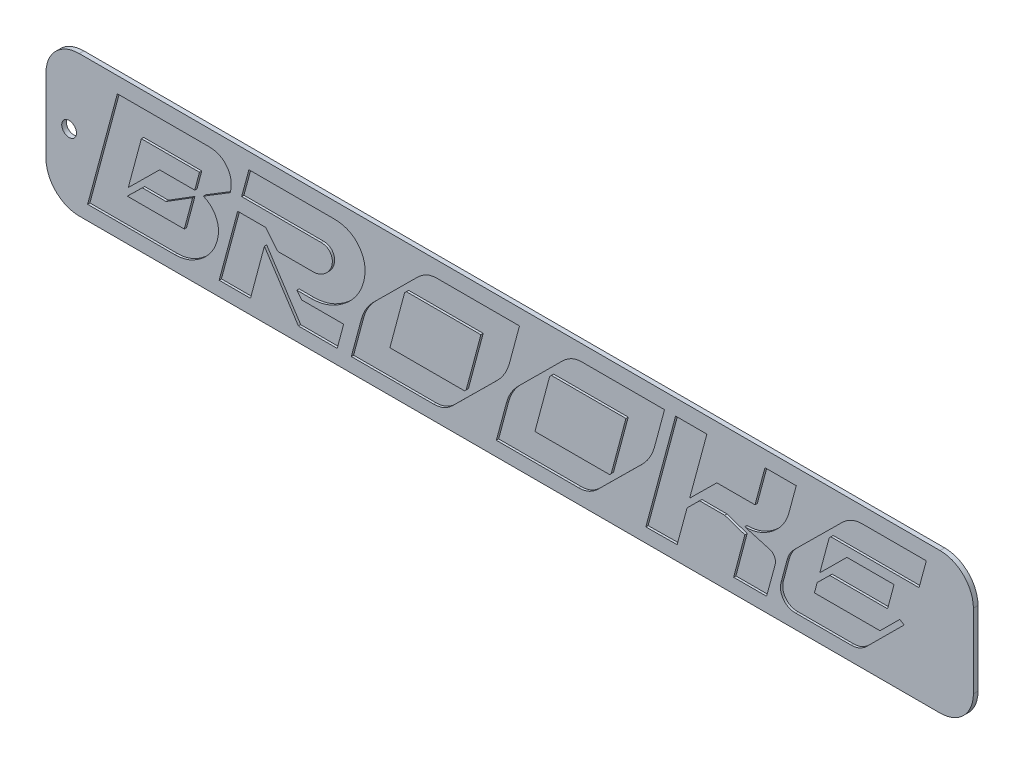
from build123d import *

# Parameters (mm, degrees)
BOSS_EXTRUDE2_DEPTH = 3.175
CUT_EXTRUDE2_DEPTH  = 1.5875
SKETCH6_R           = 5.08
CUT_EXTRUDE3_DEPTH  = 3.175


with BuildPart() as part:
    # Sketch4 → Boss-Extrude2 (new body)
    with BuildSketch(Plane.XY):
        with BuildLine():
            Line((-10.714349545, 86.925544225), (580.687098778, 86.925544225))
            ThreePointArc((580.687098778, 86.925544225), (596.851559795, 80.230005243), (603.547098778, 64.065544225))
            Line((603.547098778, 64.065544225), (603.547098778, 13.072561053))
            ThreePointArc((603.547098778, 13.072561053), (596.851559795, -3.091899965), (580.687098778, -9.787438947))
            Line((580.687098778, -9.787438947), (-10.714349545, -9.787438947))
            ThreePointArc((-10.714349545, -9.787438947), (-26.878810563, -3.091899965), (-33.574349545, 13.072561053))
            Line((-33.574349545, 13.072561053), (-33.574349545, 64.065544225))
            ThreePointArc((-33.574349545, 64.065544225), (-26.878810563, 80.230005243), (-10.714349545, 86.925544225))
        make_face()
    extrude(amount=BOSS_EXTRUDE2_DEPTH)

    # Sketch5 → Cut-Extrude2 (cut)
    # profile 1 of 6: a face of its own
    with BuildSketch(Plane.XY.offset(3.175)):
        with BuildLine():
            add(Edge.make_bspline(
                [(78.165944272, 76.089907121), (78.843123533, 76.071445818), (80.1610321, 76.035516914), (82.075809536, 75.766730208), (83.862543318, 75.31697328), (85.519780415, 74.66224216), (87.049076459, 73.830780449), (88.451967076, 72.806737053), (89.728670294, 71.61073298), (90.858642692, 70.237959946), (91.823672307, 68.743899657), (92.609389537, 67.153113723), (93.176896021, 65.476047018), (93.531194049, 63.721430644), (93.716487934, 61.891734765), (93.649787014, 59.988910899), (93.422070668, 58.001665575), (93.110476153, 56.674344069), (92.949845201, 55.990092879)],
                knots=[0, 0, 0, 0, 1.104647112, 2.14983532, 3.14775057, 4.103991838, 5.04949864, 5.980264506, 6.930364641, 7.896350518, 8.873894228, 9.826455567, 10.784034957, 11.753687545, 12.741876869, 13.777217861, 14.854127416, 16, 16, 16, 16], degree=3))
            Line((92.949845201, 55.990092879), (74.46996904, 44.681981424))
            add(Edge.make_bspline(
                [(74.46996904, 44.681981424), (74.740883892, 44.557310958), (75.170182669, 44.359754868), (75.612258275, 44.19302846), (75.775356037, 44.131517028)],
                knots=[0, 0, 0, 0, 1.262127295, 2, 2, 2, 2], degree=3))
            add(Edge.make_bspline(
                [(75.775356037, 44.131517028), (76.225974034, 43.899046623), (77.11366794, 43.441092074), (78.345882133, 42.610534835), (79.483601518, 41.696387814), (80.52662326, 40.690306405), (81.458084955, 39.578947566), (82.293657962, 38.378314707), (83.03783637, 37.087004128), (83.658269003, 35.703236058), (84.182048171, 34.266036019), (84.558182999, 32.773800443), (84.808447034, 31.247987304), (84.938305543, 29.680543737), (84.920508406, 28.06965961), (84.754913888, 26.420221909), (84.480763488, 24.72955376), (84.183503668, 23.610168615), (84.032321981, 23.040866873)],
                knots=[0, 0, 0, 0, 0.984435104, 1.939285714, 2.881007598, 3.817426453, 4.749903878, 5.693661681, 6.656357472, 7.640950646, 8.636494269, 9.624663586, 10.626026113, 11.637696297, 12.67668649, 13.751023199, 14.856205644, 16, 16, 16, 16], degree=3))
            add(Edge.make_bspline(
                [(84.032321981, 23.040866873), (83.803010098, 22.255905976), (83.345957109, 20.691361134), (82.451642441, 18.420548146), (81.335620208, 16.254824167), (80.041806594, 14.171955294), (78.565371262, 12.177050608), (76.897231841, 10.273937071), (75.040088899, 8.465639701), (73.009665532, 6.778667492), (70.897852924, 5.205057331), (68.70582888, 3.858503156), (66.496725167, 2.699532235), (64.259250798, 1.746968764), (61.987423684, 1.025551767), (59.689287994, 0.501033383), (57.362341353, 0.177520107), (55.79712062, 0.13255954), (55.01498452, 0.110092879)],
                knots=[0, 0, 0, 0, 0.992207688, 1.977618791, 2.956517026, 3.945270844, 4.9506118, 5.965172583, 7.01356654, 8.093011568, 9.167098768, 10.207118156, 11.211733991, 12.192594754, 13.154449955, 14.10064625, 15.050898635, 16, 16, 16, 16], degree=3))
            Line((55.01498452, 0.110092879), (-5.001362229, 0.110092879))
            Line((-5.001362229, 0.110092879), (15.444458204, 76.089907121))
            Line((15.444458204, 76.089907121), (78.165944272, 76.089907121))
        make_face()
        Polygon((61.416099071, 18.58996904), (67.188111455, 40.120990712), (48.912693498, 28.702786378), (32.618947368, 28.702786378), (22.285944272, 18.58996904), align=None, mode=Mode.SUBTRACT)
        Polygon((68.603591331, 45.326811146), (71.859195046, 57.61003096), (31.958390093, 57.61003096), (22.946501548, 24.031702786), (44.461795666, 45.326811146), align=None, mode=Mode.SUBTRACT)
    # profile 2 of 6: a face of its own
    with BuildSketch(Plane.XY.offset(3.175)):
        with BuildLine():
            add(Edge.make_bspline(
                [(181.684705882, 68.053126935), (182.153903389, 67.366880996), (183.084175893, 66.00626906), (184.151179969, 63.778867775), (184.941991476, 61.455712397), (185.454747871, 59.021807131), (185.648339709, 56.475326223), (185.563304406, 53.824684264), (185.201120457, 51.062974752), (184.7487514, 49.218328433), (184.515665635, 48.267863777)],
                knots=[0, 0, 0, 0, 0.961877665, 1.907103789, 2.850083582, 3.799378563, 4.780335239, 5.801073342, 6.866990356, 8, 8, 8, 8], degree=3))
            add(Edge.make_bspline(
                [(184.515665635, 48.267863777), (184.234433955, 47.328517157), (183.674022936, 45.456678976), (182.518419348, 42.757827303), (181.158688271, 40.156151552), (179.533432772, 37.680442163), (177.710152568, 35.293817541), (175.63286713, 33.025908899), (173.340605233, 30.854340343), (170.837156198, 28.836012309), (168.225941375, 26.969939526), (165.529588925, 25.358836502), (162.821877969, 23.948270612), (160.059281956, 22.845379686), (157.28537248, 21.94185992), (154.464617761, 21.339803128), (151.619740266, 20.942101185), (149.706670906, 20.894325491), (148.75120743, 20.870464396)],
                knots=[0, 0, 0, 0, 0.97804993, 1.948962355, 2.925064492, 3.904792855, 4.901205012, 5.919903121, 6.971183752, 8.049975335, 9.127306388, 10.171923768, 11.182945394, 12.171203276, 13.137691742, 14.09124472, 15.046691149, 16, 16, 16, 16], degree=3))
            Line((148.75120743, 20.870464396), (138.748482972, 20.870464396))
            Line((138.748482972, 20.870464396), (142.004086687, 16.734117647))
            Line((142.004086687, 16.734117647), (170.927058824, 16.734117647))
            Line((170.927058824, 16.734117647), (166.476160991, 0.110092879))
            Line((166.476160991, 0.110092879), (139.833684211, 0.110092879))
            Line((139.833684211, 0.110092879), (116.4625387, 35.874551084))
            Line((116.4625387, 35.874551084), (106.900185759, 0.110092879))
            Line((106.900185759, 0.110092879), (85.369164087, 0.110092879))
            Line((85.369164087, 0.110092879), (98.092755418, 47.512941176))
            Line((98.092755418, 47.512941176), (117.32755418, 47.512941176))
            Line((117.32755418, 47.512941176), (125.710340557, 37.400123839))
            Line((125.710340557, 37.400123839), (150.056594427, 37.400123839))
            add(Edge.make_bspline(
                [(150.056594427, 37.400123839), (150.742091068, 37.436394395), (152.120703767, 37.509338662), (154.142426311, 38.11136999), (156.108760757, 39.059735067), (157.974382034, 40.351378107), (159.655780257, 41.892526958), (161.077708797, 43.603529672), (162.122238544, 45.485540346), (162.827463259, 47.457155267), (163.18960497, 49.431927622), (163.137733132, 51.327686473), (162.670718354, 53.087542036), (161.80350368, 54.655633883), (160.606031484, 55.973268562), (159.110065535, 56.959900226), (157.322564804, 57.509782064), (156.052493202, 57.575605015), (155.388235294, 57.61003096)],
                knots=[0, 0, 0, 0, 1.024328987, 2.060043575, 3.13039622, 4.281662315, 5.442274921, 6.535335147, 7.596155383, 8.645921005, 9.657215708, 10.583586998, 11.460982792, 12.356435318, 13.239426359, 14.101212219, 15.006918353, 16, 16, 16, 16], degree=3))
            Line((155.388235294, 57.61003096), (100.813622291, 57.61003096))
            Line((100.813622291, 57.61003096), (105.81498452, 76.089907121))
            Line((105.81498452, 76.089907121), (164.29003096, 76.089907121))
            add(Edge.make_bspline(
                [(164.29003096, 76.089907121), (165.214093664, 76.067295423), (167.012678481, 76.023284279), (169.627865775, 75.63650897), (172.077414809, 75.01312084), (174.358706409, 74.134795281), (176.453988634, 72.984393262), (178.393215289, 71.605451252), (180.172346324, 69.970718569), (181.176939669, 68.696947537), (181.684705882, 68.053126935)],
                knots=[0, 0, 0, 0, 1.112653996, 2.165656695, 3.176610271, 4.152371772, 5.101949124, 6.048265736, 7.013506589, 8, 8, 8, 8], degree=3))
        make_face()
    # profile 3 of 6: a face of its own
    with BuildSketch(Plane.XY.offset(3.175)):
        with BuildLine():
            Line((235.079752322, 76.089907121), (291.714674923, 76.089907121))
            Line((291.714674923, 76.089907121), (284.763095975, 50.218080495))
            add(Edge.make_bspline(
                [(284.763095975, 50.218080495), (284.567392114, 49.554654571), (284.176316527, 48.228928645), (283.431192176, 46.288762966), (282.55160356, 44.403011923), (281.532432976, 42.570558879), (280.409077003, 40.773616519), (279.127463831, 39.046851806), (277.720857814, 37.364904331), (276.696304261, 36.303586564), (276.175851393, 35.764458204)],
                knots=[0, 0, 0, 0, 0.975913031, 1.950169806, 2.929973796, 3.910224675, 4.907857831, 5.918602343, 6.942691304, 8, 8, 8, 8], degree=3))
            Line((276.175851393, 35.764458204), (246.057585139, 5.976470588))
            add(Edge.make_bspline(
                [(246.057585139, 5.976470588), (245.567180593, 5.511673556), (244.604650922, 4.599404416), (243.060467594, 3.406473195), (241.473959462, 2.385058746), (239.837163115, 1.547960341), (238.145035455, 0.897979854), (236.404889876, 0.440343657), (234.616572619, 0.167393413), (233.408320855, 0.129296855), (232.799256966, 0.110092879)],
                knots=[0, 0, 0, 0, 1.088150486, 2.135741067, 3.138649684, 4.124660487, 5.092594565, 6.05353692, 7.018813456, 8, 8, 8, 8], degree=3))
            Line((232.799256966, 0.110092879), (176.164334365, 0.110092879))
            Line((176.164334365, 0.110092879), (183.115913313, 25.981919505))
            add(Edge.make_bspline(
                [(183.115913313, 25.981919505), (183.31156475, 26.645371072), (183.702535578, 27.971148241), (184.448446087, 29.910929371), (185.326105623, 31.800461991), (186.360887164, 33.634395292), (187.520474977, 35.421190898), (188.812581, 37.159516171), (190.254073948, 38.829815678), (191.288797628, 39.895431078), (191.813250774, 40.435541796)],
                knots=[0, 0, 0, 0, 0.972188851, 1.942727767, 2.918792729, 3.89888478, 4.900660299, 5.911935627, 6.941657613, 8, 8, 8, 8], degree=3))
            Line((191.813250774, 40.435541796), (221.821424149, 70.223529412))
            add(Edge.make_bspline(
                [(221.821424149, 70.223529412), (222.317267774, 70.68811599), (223.290779205, 71.600259095), (224.851884655, 72.799594193), (226.462785921, 73.806711452), (228.100345189, 74.649150324), (229.785277269, 75.305189439), (231.516532036, 75.757242357), (233.288518435, 76.032176586), (234.481145033, 76.07061432), (235.079752322, 76.089907121)],
                knots=[0, 0, 0, 0, 1.09520327, 2.15026038, 3.168190723, 4.15492977, 5.115689715, 6.0773418, 7.034972711, 8, 8, 8, 8], degree=3))
        make_face()
        Polygon((255.085201238, 19.785263158), (265.198018576, 57.61003096), (213.989102167, 57.61003096), (212.79380805, 56.414736842), (202.680990712, 18.58996904), (254, 18.58996904), align=None, mode=Mode.SUBTRACT)
    # profile 4 of 6: a face of its own
    with BuildSketch(Plane.XY.offset(3.175)):
        with BuildLine():
            Line((334.729535604, 76.089907121), (391.364458204, 76.089907121))
            Line((391.364458204, 76.089907121), (384.412879257, 50.218080495))
            add(Edge.make_bspline(
                [(384.412879257, 50.218080495), (384.217175396, 49.554654571), (383.826099809, 48.228928645), (383.080975457, 46.288762966), (382.201386842, 44.403011923), (381.182216258, 42.570558879), (380.058860285, 40.773616519), (378.777247113, 39.046851806), (377.370641096, 37.364904331), (376.346087543, 36.303586564), (375.825634675, 35.764458204)],
                knots=[0, 0, 0, 0, 0.975913031, 1.950169806, 2.929973796, 3.910224675, 4.907857831, 5.918602343, 6.942691304, 8, 8, 8, 8], degree=3))
            Line((375.825634675, 35.764458204), (345.707368421, 5.976470588))
            add(Edge.make_bspline(
                [(345.707368421, 5.976470588), (345.216963875, 5.511673556), (344.254434204, 4.599404416), (342.710250876, 3.406473195), (341.123742744, 2.385058746), (339.486946397, 1.547960341), (337.794818736, 0.897979854), (336.054673158, 0.440343657), (334.266355901, 0.167393413), (333.058104137, 0.129296855), (332.449040248, 0.110092879)],
                knots=[0, 0, 0, 0, 1.088150486, 2.135741067, 3.138649684, 4.124660487, 5.092594565, 6.05353692, 7.018813456, 8, 8, 8, 8], degree=3))
            Line((332.449040248, 0.110092879), (275.814117647, 0.110092879))
            Line((275.814117647, 0.110092879), (282.765696594, 25.981919505))
            add(Edge.make_bspline(
                [(282.765696594, 25.981919505), (282.961348032, 26.645371072), (283.35231886, 27.971148241), (284.098229368, 29.910929371), (284.975888905, 31.800461991), (286.010670446, 33.634395292), (287.170258258, 35.421190898), (288.462364282, 37.159516171), (289.90385723, 38.829815678), (290.93858091, 39.895431078), (291.463034056, 40.435541796)],
                knots=[0, 0, 0, 0, 0.972188851, 1.942727767, 2.918792729, 3.89888478, 4.900660299, 5.911935627, 6.941657613, 8, 8, 8, 8], degree=3))
            Line((291.463034056, 40.435541796), (321.47120743, 70.223529412))
            add(Edge.make_bspline(
                [(321.47120743, 70.223529412), (321.967051056, 70.68811599), (322.940562486, 71.600259095), (324.501667936, 72.799594193), (326.112569202, 73.806711452), (327.75012847, 74.649150324), (329.435060551, 75.305189439), (331.166315318, 75.757242357), (332.938301716, 76.032176586), (334.130928315, 76.07061432), (334.729535604, 76.089907121)],
                knots=[0, 0, 0, 0, 1.09520327, 2.15026038, 3.168190723, 4.15492977, 5.115689715, 6.0773418, 7.034972711, 8, 8, 8, 8], degree=3))
        make_face()
        Polygon((354.73498452, 19.785263158), (364.847801858, 57.61003096), (313.638885449, 57.61003096), (312.443591331, 56.414736842), (302.330773994, 18.58996904), (353.649783282, 18.58996904), align=None, mode=Mode.SUBTRACT)
    # profile 5 of 6: a face of its own
    with BuildSketch(Plane.XY.offset(3.175)):
        with BuildLine():
            Line((460.36123839, 76.089907121), (481.876532508, 76.089907121))
            Line((481.876532508, 76.089907121), (476.875170279, 57.61003096))
            add(Edge.make_bspline(
                [(476.875170279, 57.61003096), (476.64410063, 56.802745189), (476.183813308, 55.194643871), (475.221881293, 52.880308869), (474.09054366, 50.652891711), (472.757106403, 48.521990871), (471.247520381, 46.467990373), (469.524521447, 44.518109072), (467.610395986, 42.658648073), (465.542214785, 40.901214507), (463.364793074, 39.292058249), (461.123767595, 37.895660209), (458.872370052, 36.676420511), (456.567249196, 35.727017349), (454.24491755, 34.963627959), (451.895607435, 34.403913178), (449.50747557, 34.087044054), (447.905902269, 34.041522934), (447.102910217, 34.01869969)],
                knots=[0, 0, 0, 0, 0.992165217, 1.976378441, 2.957776605, 3.943394344, 4.94515672, 5.968568506, 7.016248138, 8.098085754, 9.17549218, 10.21433203, 11.218182751, 12.199032604, 13.157612726, 14.106381661, 15.050583276, 16, 16, 16, 16], degree=3))
            Line((447.102910217, 34.01869969), (446.442352941, 34.01869969))
            Line((446.442352941, 34.01869969), (463.506749226, 29.127430341))
            add(Edge.make_bspline(
                [(463.506749226, 29.127430341), (463.886100552, 29.007675981), (464.621775858, 28.775436579), (465.589792989, 28.156421905), (466.381943613, 27.350499576), (466.968657066, 26.368968517), (467.381818754, 25.277042086), (467.586876502, 24.103701045), (467.569439358, 22.866862617), (467.400198623, 22.048116643), (467.312817337, 21.625386997)],
                knots=[0, 0, 0, 0, 1.012473873, 1.963488656, 2.900925633, 3.874671107, 4.862039897, 5.868118012, 6.899280429, 8, 8, 8, 8], degree=3))
            Line((467.312817337, 21.625386997), (461.446439628, 0.110092879))
            Line((461.446439628, 0.110092879), (438.830216718, 0.110092879))
            Line((438.830216718, 0.110092879), (446.55244582, 29.23752322))
            Line((446.55244582, 29.23752322), (432.743653251, 33.924334365))
            Line((432.743653251, 33.924334365), (415.459071207, 33.924334365))
            Line((415.459071207, 33.924334365), (406.871826625, 25.431455108))
            Line((406.871826625, 25.431455108), (400.030340557, 0.110092879))
            Line((400.030340557, 0.110092879), (378.499318885, -0.110092879))
            Line((378.499318885, -0.110092879), (398.945139319, 76.089907121))
            Line((398.945139319, 76.089907121), (420.460433437, 76.089907121))
            Line((420.460433437, 76.089907121), (408.617585139, 32.068482972))
            Line((408.617585139, 32.068482972), (427.317647059, 50.548359133))
            Line((427.317647059, 50.548359133), (453.504024768, 50.548359133))
            Line((453.504024768, 50.548359133), (460.36123839, 76.089907121))
        make_face()
    # profile 6 of 6: a face of its own
    with BuildSketch(Plane.XY.offset(3.175)):
        with BuildLine():
            Line((505.672321981, 57.61003096), (504.477027864, 56.414736842))
            Line((504.477027864, 56.414736842), (498.060185759, 32.39876161))
            Line((498.060185759, 32.39876161), (516.650154799, 50.878637771))
            Line((516.650154799, 50.878637771), (549.048916409, 50.878637771))
            Line((549.048916409, 50.878637771), (544.598018576, 34.238885449))
            Line((544.598018576, 34.238885449), (504.917399381, 34.238885449))
            Line((504.917399381, 34.238885449), (496.22006192, 25.651640867))
            Line((496.22006192, 25.651640867), (494.364210526, 18.58996904))
            Line((494.364210526, 18.58996904), (539.376470588, 18.58996904))
            Line((539.376470588, 18.58996904), (552.965077399, 32.068482972))
            Line((552.965077399, 32.068482972), (556.000495356, 30.322724458))
            Line((556.000495356, 30.322724458), (530.348854489, 4.781176471))
            add(Edge.make_bspline(
                [(530.348854489, 4.781176471), (529.952523954, 4.40563779), (529.17533518, 3.669221032), (527.905564893, 2.72983858), (526.613378243, 1.922007685), (525.286482159, 1.249330178), (523.911043514, 0.749693532), (522.505110944, 0.386207664), (521.06129659, 0.157196007), (520.084841993, 0.125909425), (519.59120743, 0.110092879)],
                knots=[0, 0, 0, 0, 1.087710149, 2.132957327, 3.142311131, 4.123953504, 5.092881289, 6.053713067, 7.016078678, 8, 8, 8, 8], degree=3))
            Line((519.59120743, 0.110092879), (481.54625387, 0.110092879))
            add(Edge.make_bspline(
                [(481.54625387, 0.110092879), (481.089468043, 0.121495697), (480.19802192, 0.143749009), (478.900839519, 0.336897705), (477.686237407, 0.647440779), (476.557678959, 1.086514673), (475.528020459, 1.669343073), (474.554596179, 2.337531495), (473.688987759, 3.167267257), (472.922259366, 4.11011912), (472.264278053, 5.138224272), (471.746400712, 6.234858978), (471.339622119, 7.369301457), (471.113406841, 8.568042434), (470.998397994, 9.811604079), (471.036131477, 11.108834081), (471.206780316, 12.453440135), (471.429367271, 13.3493112), (471.543529412, 13.80879257)],
                knots=[0, 0, 0, 0, 1.094945795, 2.136855229, 3.137044923, 4.096584279, 5.030749513, 5.969051044, 6.920650617, 7.894578144, 8.878114772, 9.839711021, 10.797931648, 11.759527897, 12.756631189, 13.787866602, 14.865423694, 16, 16, 16, 16], degree=3))
            Line((471.543529412, 13.80879257), (475.569783282, 28.922972136))
            add(Edge.make_bspline(
                [(475.569783282, 28.922972136), (475.831518006, 29.762249011), (476.356367813, 31.445229009), (477.635052195, 33.789754209), (479.164145269, 36.050838621), (480.449651916, 37.371021477), (481.105882353, 38.04495356)],
                knots=[0, 0, 0, 0, 0.975136166, 1.955415087, 2.956272335, 4, 4, 4, 4], degree=3))
            Line((481.105882353, 38.04495356), (513.174365325, 69.798885449))
            add(Edge.make_bspline(
                [(513.174365325, 69.798885449), (513.700548666, 70.301463912), (514.726791827, 71.281669234), (516.37955844, 72.559024637), (518.063931863, 73.662817435), (519.813413966, 74.531301715), (521.590309489, 75.247349918), (523.424987133, 75.724007994), (525.299800662, 76.040497331), (526.567707555, 76.073408073), (527.203343653, 76.089907121)],
                knots=[0, 0, 0, 0, 1.104987577, 2.155115633, 3.169368792, 4.159784375, 5.118388166, 6.074904324, 7.034897349, 8, 8, 8, 8], degree=3))
            Line((527.203343653, 76.089907121), (571.224767802, 76.089907121))
            Line((571.224767802, 76.089907121), (566.223405573, 57.61003096))
            Line((566.223405573, 57.61003096), (505.672321981, 57.61003096))
        make_face()
    extrude(amount=-CUT_EXTRUDE2_DEPTH, mode=Mode.SUBTRACT)

    # Sketch6 → Cut-Extrude3 (cut)
    with BuildSketch(Plane.XY.offset(3.175)):
        with Locations((-17.70498142, 38.569052639)):
            Circle(SKETCH6_R)
    extrude(amount=-CUT_EXTRUDE3_DEPTH, mode=Mode.SUBTRACT)


solid = part.part
